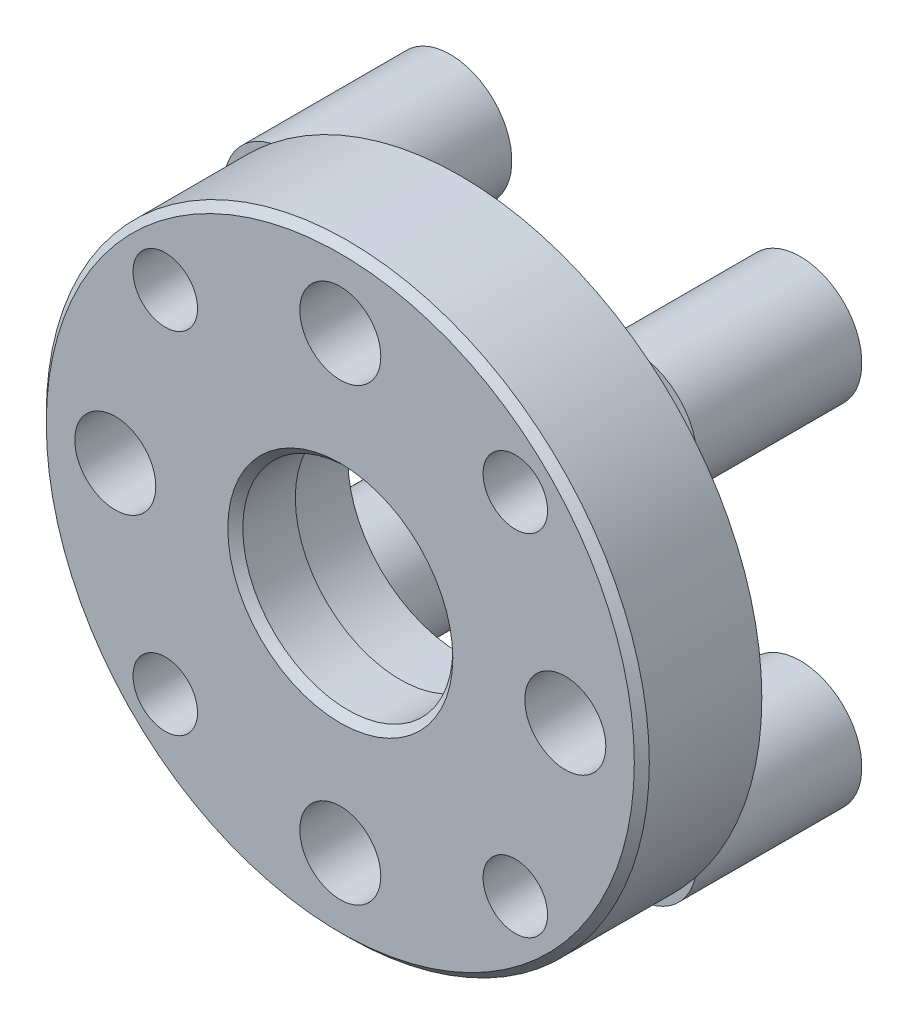
from build123d import *

# Parameters (mm, degrees)
SKETCH3_R             = 4
BOSS_EXTRUDE1_DEPTH   = 11
BOSS_EXTRUDE1_2_DEPTH = 11
BOSS_EXTRUDE1_3_DEPTH = 11
BOSS_EXTRUDE1_4_DEPTH = 11
SKETCH6_R             = 7.5
BOSS_EXTRUDE6_DEPTH   = 8
SKETCH8_R             = 1.6
CUT_EXTRUDE1_DEPTH    = 35.190934471
SKETCH9_R             = 3
CUT_EXTRUDE2_DEPTH    = 3
BOSS_EXTRUDE8_START   = -11
SKETCH10_R            = 4.1
SKETCH10_R_2          = 4
BOSS_EXTRUDE8_DEPTH   = 11
SKETCH11_R            = 2.7
SKETCH11_R_2          = 2.15
CUT_EXTRUDE3_DEPTH    = 8
BOSS_EXTRUDE9_START   = -4
SKETCH12_R            = 7.5
SKETCH12_R_2          = 7
BOSS_EXTRUDE9_DEPTH   = 4
CHAMFER1_SIZE         = 0.5


with BuildPart() as part:
    # Sketch3 → Boss-Extrude1 (new body)
    with BuildSketch(Plane(origin=(0, 0, 23.23473679), x_dir=(-1, 0, 0), z_dir=(0, 0, -1))):
        with Locations((-11.66726189, 11.66726189)):
            Circle(SKETCH3_R)
    extrude(amount=BOSS_EXTRUDE1_DEPTH)



with BuildPart() as body_2:
    # Sketch3 → Boss-Extrude1 2 (new body)
    with BuildSketch(Plane(origin=(0, 0, 23.23473679), x_dir=(-1, 0, 0), z_dir=(0, 0, -1))):
        with Locations((11.66726189, 11.66726189)):
            Circle(SKETCH3_R)
    extrude(amount=BOSS_EXTRUDE1_2_DEPTH)


with BuildPart() as body_3:
    # Sketch3 → Boss-Extrude1 3 (new body)
    with BuildSketch(Plane(origin=(0, 0, 23.23473679), x_dir=(-1, 0, 0), z_dir=(0, 0, -1))):
        with Locations((11.66726189, -11.66726189)):
            Circle(SKETCH3_R)
    extrude(amount=BOSS_EXTRUDE1_3_DEPTH)


with BuildPart() as body_4:
    # Sketch3 → Boss-Extrude1 4 (new body)
    with BuildSketch(Plane(origin=(0, 0, 23.23473679), x_dir=(-1, 0, 0), z_dir=(0, 0, -1))):
        with Locations((-11.66726189, -11.66726189)):
            Circle(SKETCH3_R)
    extrude(amount=BOSS_EXTRUDE1_4_DEPTH)


with BuildPart() as part_1:
    add(part.part)

    add(body_2.part)  # Boss-Extrude6 merges body 2

    add(body_3.part)  # Boss-Extrude6 merges body 3

    add(body_4.part)  # Boss-Extrude6 merges body 4
    # Sketch6 → Boss-Extrude6 (add)
    with BuildSketch(Plane.XY.offset(23.23473679)):
        with BuildLine():
            ThreePointArc((16.992766074, -10.735730117), (19.607007689, 4.424392555), (10.735730117, 16.992766074))
            ThreePointArc((10.735730117, 16.992766074), (-4.424392555, 19.607007689), (-16.992766074, 10.735730117))
            ThreePointArc((-16.992766074, 10.735730117), (-19.607007689, -4.424392555), (-10.735730117, -16.992766074))
            ThreePointArc((-10.735730117, -16.992766074), (4.424392555, -19.607007689), (16.992766074, -10.735730117))
        make_face()
        Circle(SKETCH6_R, mode=Mode.SUBTRACT)
    extrude(amount=BOSS_EXTRUDE6_DEPTH)

    # Sketch8 → Cut-Extrude1 (cut, through all)
    with BuildSketch(Plane.XY.offset(31.23473679)):
        with Locations((11.66726189, 11.66726189)):
            Circle(SKETCH8_R)
        with Locations((11.66726189, -11.66726189)):
            Circle(SKETCH8_R)
        with Locations((-11.66726189, -11.66726189)):
            Circle(SKETCH8_R)
        with Locations((-11.66726189, 11.66726189)):
            Circle(SKETCH8_R)
    extrude(amount=-CUT_EXTRUDE1_DEPTH, mode=Mode.SUBTRACT)

    # Sketch9 → Cut-Extrude2 (cut)
    with BuildSketch(Plane.XY.offset(12.23473679)):
        with Locations(Location((11.66726189, 11.66726189, 0), (0, 0, 180))):
            Circle(SKETCH9_R)
        with Locations(Location((11.66726189, -11.66726189, 0), (0, 0, 180))):
            Circle(SKETCH9_R)
        with Locations(Location((-11.66726189, -11.66726189, 0), (0, 0, 180))):
            Circle(SKETCH9_R)
        with Locations(Location((-11.66726189, 11.66726189, 0), (0, 0, 180))):
            Circle(SKETCH9_R)
    extrude(amount=CUT_EXTRUDE2_DEPTH, mode=Mode.SUBTRACT)

    # Sketch10 → Boss-Extrude8 (add)
    # profile 1 of 4: a face of its own
    with BuildSketch(Plane(origin=(0, 0, 12.23473679), x_dir=(-1, 0, 0), z_dir=(0, 0, -1)).offset(BOSS_EXTRUDE8_START)):
        with Locations((11.66726189, 11.66726189)):
            Circle(SKETCH10_R)
        with Locations((11.66726189, 11.66726189)):
            Circle(SKETCH10_R_2, mode=Mode.SUBTRACT)
    # profile 2 of 4: a face of its own
    with BuildSketch(Plane(origin=(0, 0, 12.23473679), x_dir=(-1, 0, 0), z_dir=(0, 0, -1)).offset(BOSS_EXTRUDE8_START)):
        with Locations((11.66726189, -11.66726189)):
            Circle(SKETCH10_R)
        with Locations((11.66726189, -11.66726189)):
            Circle(SKETCH10_R_2, mode=Mode.SUBTRACT)
    # profile 3 of 4: a face of its own
    with BuildSketch(Plane(origin=(0, 0, 12.23473679), x_dir=(-1, 0, 0), z_dir=(0, 0, -1)).offset(BOSS_EXTRUDE8_START)):
        with Locations((-11.66726189, -11.66726189)):
            Circle(SKETCH10_R)
        with Locations((-11.66726189, -11.66726189)):
            Circle(SKETCH10_R_2, mode=Mode.SUBTRACT)
    # profile 4 of 4: a face of its own
    with BuildSketch(Plane(origin=(0, 0, 12.23473679), x_dir=(-1, 0, 0), z_dir=(0, 0, -1)).offset(BOSS_EXTRUDE8_START)):
        with Locations((-11.66726189, 11.66726189)):
            Circle(SKETCH10_R)
        with Locations((-11.66726189, 11.66726189)):
            Circle(SKETCH10_R_2, mode=Mode.SUBTRACT)
    extrude(amount=BOSS_EXTRUDE8_DEPTH)

    # Sketch11 → Cut-Extrude3 (cut)
    with BuildSketch(Plane.XY.offset(31.23473679)):
        with Locations((0, 15)):
            Circle(SKETCH11_R)
        with Locations((15, 0)):
            Circle(SKETCH11_R)
        with Locations((0, -15)):
            Circle(SKETCH11_R)
        with Locations((-15, 0)):
            Circle(SKETCH11_R)
        with Locations((-11.66726189, 11.66726189)):
            Circle(SKETCH11_R_2)
        with Locations((11.66726189, 11.66726189)):
            Circle(SKETCH11_R_2)
        with Locations((11.66726189, -11.66726189)):
            Circle(SKETCH11_R_2)
        with Locations((-11.66726189, -11.66726189)):
            Circle(SKETCH11_R_2)
    extrude(amount=-CUT_EXTRUDE3_DEPTH, mode=Mode.SUBTRACT)

    # Sketch12 → Boss-Extrude9 (add)
    with BuildSketch(Plane.XY.offset(31.23473679).offset(BOSS_EXTRUDE9_START)):
        Circle(SKETCH12_R)
        Circle(SKETCH12_R_2, mode=Mode.SUBTRACT)
    extrude(amount=BOSS_EXTRUDE9_DEPTH)

    # Chamfer1
    chamfer1_edges = [part_1.edges().sort_by_distance(p)[0] for p in [
        (-10.735730117, -16.992766074, 31.23473679),
        (-7, 0, 31.23473679),
    ]]
    chamfer(chamfer1_edges, length=CHAMFER1_SIZE)


solid = part_1.part
